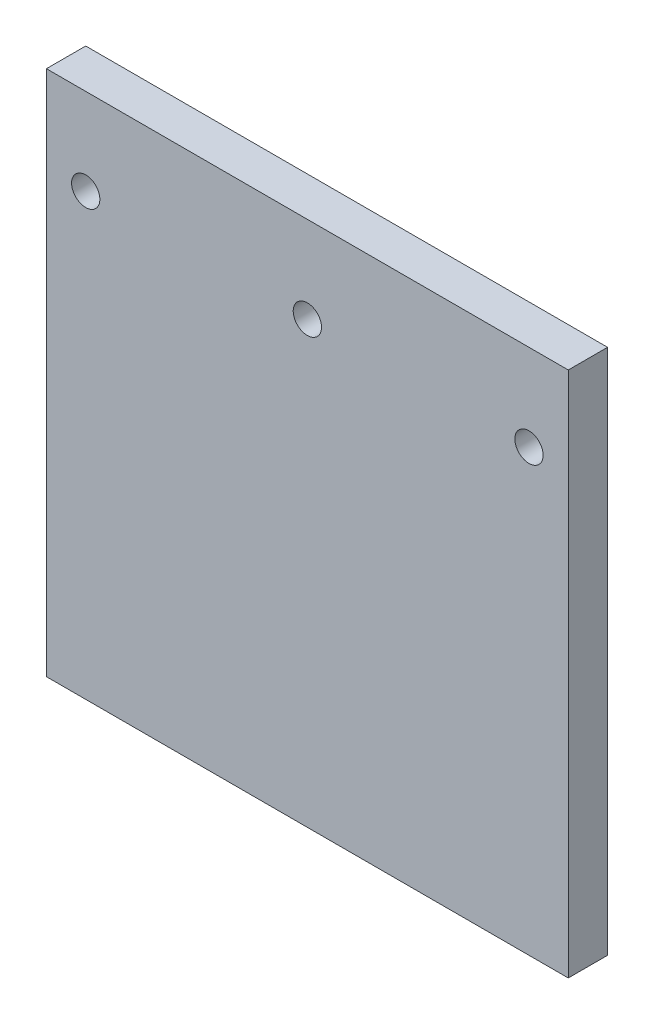
from build123d import *
from build123d.topology import SkipClean

# Parameters (mm, degrees)
SKETCH1_W                = 50
SKETCH1_H                = 9.1
BOSS_EXTRUDE1_DEPTH      = 2
SKETCH2_W                = 25
SKETCH2_H                = 6.6
CUT_EXTRUDE1_DEPTH       = 2
SKETCH3_R                = 1.8
CUT_EXTRUDE2_DEPTH       = 2
SKETCH4_W                = 66.4
SKETCH4_H                = 130
BOSS_EXTRUDE2_DEPTH      = 2
SKETCH5_W                = 66.4
SKETCH5_H                = 2
BOSS_EXTRUDE3_DEPTH      = 2.5
SKETCH6_W                = 8.6
SKETCH6_H                = 62.5
BOSS_EXTRUDE4_DEPTH      = 2
SKETCH7_R                = 1.8
SKETCH7_W                = 3
SKETCH7_H                = 5
CUT_EXTRUDE3_DEPTH       = 2
SKETCH8_W                = 25
SKETCH8_H                = 45
CUT_EXTRUDE4_DEPTH       = 20
SKETCH9_W                = 25
SKETCH9_H                = 10
BOSS_EXTRUDE5_DEPTH      = 2
SKETCH10_W               = 34.7
SKETCH10_H               = 27.07
BOSS_EXTRUDE6_DEPTH      = 2
SKETCH11_R               = 1.8
CUT_EXTRUDE5_DEPTH       = 2
SKETCH12_R               = 1.8
CUT_EXTRUDE6_DEPTH       = 2
SKETCH13_W               = 2
SKETCH13_H               = 2
BOSS_EXTRUDE7_DEPTH      = 44
SKETCH14_W               = 2
SKETCH14_H               = 2
BOSS_EXTRUDE8_DEPTH      = 46
SKETCH16_W               = 42
SKETCH16_H               = 43
BOSS_EXTRUDE10_DEPTH     = 2
SKETCH18_R               = 1.8
CUT_EXTRUDE7_DEPTH       = 2
BOSS_EXTRUDE12_DEPTH     = 2
SKETCH21_W               = 2
SKETCH21_H               = 2
BOSS_EXTRUDE13_DEPTH     = 10
SKETCH25_W               = 3
SKETCH25_H               = 5
CUT_EXTRUDE8_DEPTH       = 10
SKETCH26_W               = 6.2
SKETCH26_H               = 13
SKETCH26_W_2             = 21
SKETCH26_H_2             = 6.6
BOSS_EXTRUDE14_DEPTH     = 2
SKETCH27_W               = 2
SKETCH27_H               = 27
SKETCH27_H_2             = 24.93
BOSS_EXTRUDE15_DEPTH     = 2
SKETCH29_W               = 10
SKETCH29_H               = 10
BOSS_EXTRUDE19_DEPTH     = 2
SKETCH41_R               = 1.8
CUT_EXTRUDE15_DEPTH      = 2
BOSS_EXTRUDE26_DEPTH     = 2
SKETCH43_W               = 70.4
SKETCH43_H               = 2
BOSS_EXTRUDE27_DEPTH     = 11
SKETCH44_W               = 10
SKETCH44_H               = 5
BOSS_EXTRUDE28_DEPTH     = 2
SKETCH45_R               = 1.8
BOSS_EXTRUDE29_DEPTH     = 2
SKETCH46_R               = 1.8
CUT_EXTRUDE16_DEPTH      = 2
SKETCH47_W               = 10
SKETCH47_H               = 1
BOSS_EXTRUDE30_DEPTH     = 2
SKETCH48_W               = 32.7
SKETCH48_H               = 31.07
SKETCH48_W_2             = 101.75
SKETCH48_H_2             = 120.487369876
CUT_EXTRUDE17_DEPTH      = 20
SKETCH50_W               = 66.4
SKETCH50_H               = 81.07
CUT_EXTRUDE19_DEPTH      = 20
SKETCH51_W               = 70.4
SKETCH51_H               = 85.07
SKETCH51_W_2             = 66.4
SKETCH51_H_2             = 81.07
BOSS_EXTRUDE31_DEPTH     = 20
SKETCH52_W               = 10
SKETCH52_H               = 1
BOSS_EXTRUDE32_DEPTH     = 2
SKETCH53_W               = 10
SKETCH53_H               = 4
CUT_EXTRUDE20_DEPTH      = 2
BOSS_EXTRUDE33_START     = 1
SKETCH54_W               = 10
SKETCH54_H               = 12
SKETCH54_R               = 1.8
BOSS_EXTRUDE33_DEPTH     = 1
CUT_EXTRUDE23_DEPTH      = 96
CUT_EXTRUDE23_DEPTH_BACK = 16
SKETCH59_R               = 1.8
SKETCH62_W               = 66.985033768
SKETCH62_H               = 11.249394984
BOSS_EXTRUDE38_DEPTH     = 1
SKETCH65_R               = 1.8
CUT_EXTRUDE27_DEPTH      = 3
SKETCH66_R               = 1
CUT_EXTRUDE28_DEPTH      = 87
BOSS_EXTRUDE41_DEPTH     = 2
BOSS_EXTRUDE42_DEPTH     = 2
BOSS_EXTRUDE43_DEPTH     = 2
SKETCH68_W               = 6.791832398
SKETCH68_H               = 8.144168394
SKETCH68_W_2             = 5.485710784
SKETCH68_W_3             = 7.764004839
SKETCH68_H_2             = 11.628907231
BOSS_EXTRUDE44_DEPTH     = 2
BOSS_EXTRUDE45_DEPTH     = 2
SKETCH70_R               = 1.8
CUT_EXTRUDE29_DEPTH      = 83
SKETCH72_W               = 105.024650177
SKETCH72_H               = 68.649418558
CUT_EXTRUDE33_DEPTH      = 92
SKETCH73_W               = 2
SKETCH73_H               = 22
CUT_EXTRUDE34_DEPTH      = 92
SKETCH74_W               = 66.4
SKETCH74_H               = 2
BOSS_EXTRUDE46_DEPTH     = 45
SKETCH75_W               = 66.4
SKETCH75_H               = 67
SKETCH75_R               = 1.8
BOSS_EXTRUDE47_DEPTH     = 3


with BuildPart() as part:
    # Sketch1 → Boss-Extrude1 (new body)
    with BuildSketch(Plane(origin=(0, 0, 0), x_dir=(1, 0, 0), z_dir=(0, 1, 0))):
        with Locations((25, 4.55)):
            Rectangle(SKETCH1_W, SKETCH1_H)
    extrude(amount=BOSS_EXTRUDE1_DEPTH)

    # Sketch2 → Cut-Extrude1 (cut)
    with BuildSketch(Plane(origin=(0, 2, 0), x_dir=(1, 0, 0), z_dir=(0, 1, 0))):
        with Locations((25, 5.8)):
            Rectangle(SKETCH2_W, SKETCH2_H)
    extrude(amount=-CUT_EXTRUDE1_DEPTH, mode=Mode.SUBTRACT)

    # Sketch3 → Cut-Extrude2 (cut)
    with BuildSketch(Plane(origin=(0, 2, 0), x_dir=(1, 0, 0), z_dir=(0, 1, 0))):
        with Locations(Location((6.25, 5.8, 0), (0, 0, 270))):
            Circle(SKETCH3_R)
        with Locations(Location((43.75, 5.8, 0), (0, 0, 270))):
            Circle(SKETCH3_R)
    extrude(amount=-CUT_EXTRUDE2_DEPTH, mode=Mode.SUBTRACT)

    # Sketch4 → Boss-Extrude2 (add)
    with BuildSketch(Plane(origin=(0, 2, 0), x_dir=(1, 0, 0), z_dir=(0, 1, 0))):
        with Locations((25, -65)):
            Rectangle(SKETCH4_W, SKETCH4_H)
    extrude(amount=-BOSS_EXTRUDE2_DEPTH)

    # Sketch5 → Boss-Extrude3 (add)
    with BuildSketch(Plane.XY.offset(130)):
        with Locations((25, 1)):
            Rectangle(SKETCH5_W, SKETCH5_H)
    extrude(amount=BOSS_EXTRUDE3_DEPTH)

    # Sketch6 → Boss-Extrude4 (add)
    with BuildSketch(Plane(origin=(0, 2, 0), x_dir=(1, 0, 0), z_dir=(0, 1, 0))):
        with Locations((-12.5, -101.25)):
            Rectangle(SKETCH6_W, SKETCH6_H)
        with Locations((62.5, -101.25)):
            Rectangle(SKETCH6_W, SKETCH6_H)
    extrude(amount=-BOSS_EXTRUDE4_DEPTH)

    # Sketch7 → Cut-Extrude3 (cut)
    with BuildSketch(Plane(origin=(0, 2, 0), x_dir=(1, 0, 0), z_dir=(0, 1, 0))):
        with Locations(Location((-13.5, -77, 0), (0, 0, 270))):
            Circle(SKETCH7_R)
        with Locations(Location((-13.5, -101.25, 0), (0, 0, 270))):
            Circle(SKETCH7_R)
        with Locations(Location((-13.5, -125.5, 0), (0, 0, 270))):
            Circle(SKETCH7_R)
        with Locations(Location((63.5, -77, 0), (0, 0, 270))):
            Circle(SKETCH7_R)
        with Locations(Location((63.5, -101.25, 0), (0, 0, 270))):
            Circle(SKETCH7_R)
        with Locations(Location((63.5, -125.5, 0), (0, 0, 270))):
            Circle(SKETCH7_R)
        with Locations((-13.5, -117.5)):
            Rectangle(SKETCH7_W, SKETCH7_H)
        with Locations((63.5, -117.5)):
            Rectangle(SKETCH7_W, SKETCH7_H)
    extrude(amount=-CUT_EXTRUDE3_DEPTH, mode=Mode.SUBTRACT)

    # Sketch8 → Cut-Extrude4 (cut)
    with BuildSketch(Plane(origin=(0, 2, 0), x_dir=(1, 0, 0), z_dir=(0, 1, 0))):
        with Locations((25, -22.5)):
            Rectangle(SKETCH8_W, SKETCH8_H)
    extrude(amount=-CUT_EXTRUDE4_DEPTH, mode=Mode.SUBTRACT)

    # Sketch9 → Boss-Extrude5 (add)
    with BuildSketch(Plane(origin=(0, 2, 0), x_dir=(1, 0, 0), z_dir=(0, 1, 0))):
        with Locations((25, -5)):
            Rectangle(SKETCH9_W, SKETCH9_H)
    extrude(amount=-BOSS_EXTRUDE5_DEPTH)

    # Sketch10 → Boss-Extrude6 (add)
    with BuildSketch(Plane(origin=(0, 2, 0), x_dir=(1, 0, 0), z_dir=(0, 1, 0))):
        with Locations((-25.55, -29.535)):
            Rectangle(SKETCH10_W, SKETCH10_H)
        with Locations((75.55, -29.535)):
            Rectangle(SKETCH10_W, SKETCH10_H)
    extrude(amount=-BOSS_EXTRUDE6_DEPTH)

    # Sketch11 → Cut-Extrude5 (cut)
    with BuildSketch(Plane(origin=(0, 2, 0), x_dir=(1, 0, 0), z_dir=(0, 1, 0))):
        with Locations(Location((-36.9, -19.25, 0), (0, 0, 270))):
            Circle(SKETCH11_R)
        with Locations(Location((-36.9, -39.82, 0), (0, 0, 270))):
            Circle(SKETCH11_R)
        with Locations(Location((-22.6, -19.25, 0), (0, 0, 270))):
            Circle(SKETCH11_R)
        with Locations(Location((-22.6, -39.82, 0), (0, 0, 270))):
            Circle(SKETCH11_R)
    extrude(amount=-CUT_EXTRUDE5_DEPTH, mode=Mode.SUBTRACT)

    # Sketch12 → Cut-Extrude6 (cut)
    with BuildSketch(Plane(origin=(0, 2, 0), x_dir=(1, 0, 0), z_dir=(0, 1, 0))):
        with Locations(Location((72.6, -19.25, 0), (0, 0, 270))):
            Circle(SKETCH12_R)
        with Locations(Location((86.9, -19.25, 0), (0, 0, 270))):
            Circle(SKETCH12_R)
        with Locations(Location((72.6, -39.82, 0), (0, 0, 270))):
            Circle(SKETCH12_R)
        with Locations(Location((86.9, -39.82, 0), (0, 0, 270))):
            Circle(SKETCH12_R)
    extrude(amount=-CUT_EXTRUDE6_DEPTH, mode=Mode.SUBTRACT)

    # Sketch13 → Boss-Extrude7 (add)
    with BuildSketch(Plane.ZY.offset(42.9)):
        with Locations((15, 1)):
            Rectangle(SKETCH13_W, SKETCH13_H)
        with Locations((44.07, 1)):
            Rectangle(SKETCH13_W, SKETCH13_H)
    extrude(amount=-BOSS_EXTRUDE7_DEPTH)

    # Sketch14 → Boss-Extrude8 (add)
    with BuildSketch(Plane(origin=(92.9, 0, 0), x_dir=(0, 0, -1), z_dir=(1, 0, 0))):
        with Locations((-15, 1)):
            Rectangle(SKETCH14_W, SKETCH14_H)
        with Locations((-44.07, 1)):
            Rectangle(SKETCH14_W, SKETCH14_H)
    extrude(amount=-BOSS_EXTRUDE8_DEPTH)

    # Sketch16 → Boss-Extrude10 (add)
    with BuildSketch(Plane(origin=(0, 2, 0), x_dir=(1, 0, 0), z_dir=(0, 1, 0))):
        with Locations((25, -154)):
            Rectangle(SKETCH16_W, SKETCH16_H)
    extrude(amount=-BOSS_EXTRUDE10_DEPTH)

    # Sketch18 → Cut-Extrude7 (cut)
    with BuildSketch(Plane(origin=(0, 2, 0), x_dir=(1, 0, 0), z_dir=(0, 1, 0))):
        with Locations(Location((8.74, -171.03, 0), (0, 0, 270))):
            Circle(SKETCH18_R)
        with Locations(Location((41.26, -171.03, 0), (0, 0, 270))):
            Circle(SKETCH18_R)
        with Locations(Location((8.74, -138.5, 0), (0, 0, 270))):
            Circle(SKETCH18_R)
        with Locations(Location((41.26, -138.5, 0), (0, 0, 270))):
            Circle(SKETCH18_R)
    extrude(amount=-CUT_EXTRUDE7_DEPTH, mode=Mode.SUBTRACT)

    # Sketch20 → Boss-Extrude12 (add)
    with BuildSketch(Plane(origin=(0, 2, 0), x_dir=(1, 0, 0), z_dir=(0, 1, 0))):
        with BuildLine():
            Line((-2, -132.5), (4, -132.5))
            Line((4, -132.5), (4, -138.5))
            ThreePointArc((4, -138.5), (2.242640687, -134.257359313), (-2, -132.5))
        make_face()
        with BuildLine():
            ThreePointArc((52, -132.5), (47.757359313, -134.257359313), (46, -138.5))
            Line((46, -138.5), (46, -132.5))
            Line((46, -132.5), (52, -132.5))
        make_face()
    extrude(amount=-BOSS_EXTRUDE12_DEPTH)

    # Sketch21 → Boss-Extrude13 (add)
    with BuildSketch(Plane(origin=(0, 0, -9.1), x_dir=(-1, 0, 0), z_dir=(0, 0, -1))):
        with Locations((-51, 1)):
            Rectangle(SKETCH21_W, SKETCH21_H)
        with Locations((-36.5, 1)):
            Rectangle(SKETCH21_W, SKETCH21_H)
        with Locations((-13.5, 1)):
            Rectangle(SKETCH21_W, SKETCH21_H)
        with Locations((1, 1)):
            Rectangle(SKETCH21_W, SKETCH21_H)
    extrude(amount=-BOSS_EXTRUDE13_DEPTH)

    # Sketch25 → Cut-Extrude8 (cut)
    with BuildSketch(Plane(origin=(0, 2, 0), x_dir=(1, 0, 0), z_dir=(0, 1, 0))):
        with Locations((-11.7, -22.5)):
            Rectangle(SKETCH25_W, SKETCH25_H)
        with Locations((-11.7, -36.57)):
            Rectangle(SKETCH25_W, SKETCH25_H)
        with Locations((61.7, -22.5)):
            Rectangle(SKETCH25_W, SKETCH25_H)
        with Locations((61.7, -36.57)):
            Rectangle(SKETCH25_W, SKETCH25_H)
    extrude(amount=-CUT_EXTRUDE8_DEPTH, mode=Mode.SUBTRACT)

    # Sketch26 → Boss-Extrude14 (add)
    with BuildSketch(Plane(origin=(0, 2, 0), x_dir=(1, 0, 0), z_dir=(0, 1, 0))):
        with Locations((-5.1, 6.5)):
            Rectangle(SKETCH26_W, SKETCH26_H)
        Polygon((-2, 13), (-2, 9.1), (14.5, 9.1), (35.5, 9.1), (52, 9.1), (52, 13), align=None)
        with Locations((25, 5.8)):
            Rectangle(SKETCH26_W_2, SKETCH26_H_2)
        with Locations((55.1, 6.5)):
            Rectangle(SKETCH26_W, SKETCH26_H)
    extrude(amount=-BOSS_EXTRUDE14_DEPTH)

    # Sketch27 → Boss-Extrude15 (add)
    with BuildSketch(Plane(origin=(0, 2, 0), x_dir=(1, 0, 0), z_dir=(0, 1, 0))):
        with Locations((-9.2, -0.5)):
            Rectangle(SKETCH27_W, SKETCH27_H)
        with Locations((-9.2, -57.535)):
            Rectangle(SKETCH27_W, SKETCH27_H_2)
        with Locations((59.2, -0.5)):
            Rectangle(SKETCH27_W, SKETCH27_H)
        with Locations((59.2, -57.535)):
            Rectangle(SKETCH27_W, SKETCH27_H_2)
    extrude(amount=-BOSS_EXTRUDE15_DEPTH)

    # Sketch29 → Boss-Extrude19 (add)
    with BuildSketch(Plane(origin=(0, 2, 0), x_dir=(1, 0, 0), z_dir=(0, 1, 0))):
        with Locations((-15.2, -9)):
            Rectangle(SKETCH29_W, SKETCH29_H)
        with Locations((-15.2, -50.07)):
            Rectangle(SKETCH29_W, SKETCH29_H)
        with Locations((65.2, -9)):
            Rectangle(SKETCH29_W, SKETCH29_H)
        with Locations((65.2, -50.07)):
            Rectangle(SKETCH29_W, SKETCH29_H)
    extrude(amount=-BOSS_EXTRUDE19_DEPTH)

    # Sketch41 → Cut-Extrude15 (cut)
    with BuildSketch(Plane(origin=(0, 2, 0), x_dir=(1, 0, 0), z_dir=(0, 1, 0))):
        with Locations(Location((-15.2, -9, 0), (0, 0, 270))):
            Circle(SKETCH41_R)
        with Locations(Location((-15.2, -50.07, 0), (0, 0, 270))):
            Circle(SKETCH41_R)
        with Locations(Location((65.2, -9, 0), (0, 0, 270))):
            Circle(SKETCH41_R)
        with Locations(Location((65.2, -50.07, 0), (0, 0, 270))):
            Circle(SKETCH41_R)
    extrude(amount=-CUT_EXTRUDE15_DEPTH, mode=Mode.SUBTRACT)

    # Sketch42 → Boss-Extrude26 (add)
    with BuildSketch(Plane(origin=(0, 2, 0), x_dir=(1, 0, 0), z_dir=(0, 1, 0))):
        with BuildLine():
            Line((-16.8, -70), (-10.2, -70))
            Line((-10.2, -70), (-10.2, -63.4))
            ThreePointArc((-10.2, -63.4), (-12.133095244, -68.066904756), (-16.8, -70))
        make_face()
        with BuildLine():
            Line((60.2, -63.4), (60.2, -70))
            Line((60.2, -70), (66.8, -70))
            ThreePointArc((66.8, -70), (62.133095244, -68.066904756), (60.2, -63.4))
        make_face()
    extrude(amount=-BOSS_EXTRUDE26_DEPTH)

    # Sketch43 → Boss-Extrude27 (add)
    with BuildSketch(Plane(origin=(0, 0, -13), x_dir=(-1, 0, 0), z_dir=(0, 0, -1))):
        with Locations((-25, 1)):
            Rectangle(SKETCH43_W, SKETCH43_H)
    extrude(amount=BOSS_EXTRUDE27_DEPTH)

    # Sketch44 → Boss-Extrude28 (add)
    with BuildSketch(Plane(origin=(0, 2, 0), x_dir=(1, 0, 0), z_dir=(0, 1, 0))):
        with Locations((-15.2, -57.57)):
            Rectangle(SKETCH44_W, SKETCH44_H)
        with Locations((65.2, -57.57)):
            Rectangle(SKETCH44_W, SKETCH44_H)
    extrude(amount=-BOSS_EXTRUDE28_DEPTH)

    # Sketch45 → Boss-Extrude29 (add)
    with BuildSketch(Plane(origin=(0, 2, 0), x_dir=(1, 0, 0), z_dir=(0, 1, 0))):
        with Locations((-15.2, -50.07)):
            Circle(SKETCH45_R)
        with Locations((65.2, -50.07)):
            Circle(SKETCH45_R)
    extrude(amount=-BOSS_EXTRUDE29_DEPTH)

    # Sketch46 → Cut-Extrude16 (cut)
    with BuildSketch(Plane(origin=(0, 2, 0), x_dir=(1, 0, 0), z_dir=(0, 1, 0))):
        with Locations(Location((-15.2, -55.07, 0), (0, 0, 270))):
            Circle(SKETCH46_R)
        with Locations(Location((65.2, -55.07, 0), (0, 0, 270))):
            Circle(SKETCH46_R)
    extrude(amount=-CUT_EXTRUDE16_DEPTH, mode=Mode.SUBTRACT)

    # Sketch47 → Boss-Extrude30 (add)
    with BuildSketch(Plane(origin=(0, 2, 0), x_dir=(1, 0, 0), z_dir=(0, 1, 0))):
        with Locations((-15.2, -3.5)):
            Rectangle(SKETCH47_W, SKETCH47_H)
        with Locations((-15.2, -60.57)):
            Rectangle(SKETCH47_W, SKETCH47_H)
        with Locations((65.2, -3.5)):
            Rectangle(SKETCH47_W, SKETCH47_H)
        with Locations((65.2, -60.57)):
            Rectangle(SKETCH47_W, SKETCH47_H)
    extrude(amount=-BOSS_EXTRUDE30_DEPTH)

    # Sketch48 → Cut-Extrude17 (cut)
    with BuildSketch(Plane(origin=(0, 2, 0), x_dir=(1, 0, 0), z_dir=(0, 1, 0))):
        with Locations((-26.55, -29.535)):
            Rectangle(SKETCH48_W, SKETCH48_H)
        with Locations((76.55, -29.535)):
            Rectangle(SKETCH48_W, SKETCH48_H)
        with Locations((30.675, -121.313684938)):
            Rectangle(SKETCH48_W_2, SKETCH48_H_2)
    extrude(amount=-CUT_EXTRUDE17_DEPTH, mode=Mode.SUBTRACT)

    # Sketch50 → Cut-Extrude19 (cut)
    with BuildSketch(Plane(origin=(0, 2, 0), x_dir=(1, 0, 0), z_dir=(0, 1, 0))):
        with Locations((25, -18.535)):
            Rectangle(SKETCH50_W, SKETCH50_H)
    extrude(amount=-CUT_EXTRUDE19_DEPTH, mode=Mode.SUBTRACT)

    # Sketch51 → Boss-Extrude31 (add)
    with BuildSketch(Plane(origin=(0, 2, 0), x_dir=(1, 0, 0), z_dir=(0, 1, 0))):
        with Locations((25, -18.535)):
            Rectangle(SKETCH51_W, SKETCH51_H)
        with Locations((25, -18.535)):
            Rectangle(SKETCH51_W_2, SKETCH51_H_2, mode=Mode.SUBTRACT)
    extrude(amount=BOSS_EXTRUDE31_DEPTH)

    # Sketch52 → Boss-Extrude32 (add)
    with BuildSketch(Plane(origin=(0, 2, 0), x_dir=(1, 0, 0), z_dir=(0, 1, 0))):
        with Locations((-15.2, -14.5)):
            Rectangle(SKETCH52_W, SKETCH52_H)
        with Locations((65.2, -14.5)):
            Rectangle(SKETCH52_W, SKETCH52_H)
    extrude(amount=-BOSS_EXTRUDE32_DEPTH)

    # Sketch53 → Cut-Extrude20 (cut)
    with BuildSketch(Plane(origin=(0, 2, 0), x_dir=(1, 0, 0), z_dir=(0, 1, 0))):
        with Locations((-15.2, -47.07)):
            Rectangle(SKETCH53_W, SKETCH53_H)
        with Locations((65.2, -47.07)):
            Rectangle(SKETCH53_W, SKETCH53_H)
    extrude(amount=-CUT_EXTRUDE20_DEPTH, mode=Mode.SUBTRACT)

    # Sketch54 → Boss-Extrude33 (add)
    # profile 1 of 4: a face of its own
    with BuildSketch(Plane(origin=(0, 2, 0), x_dir=(1, 0, 0), z_dir=(0, 1, 0)).offset(BOSS_EXTRUDE33_START)):
        with Locations((-15.2, -9)):
            Rectangle(SKETCH54_W, SKETCH54_H)
        with Locations(Location((-15.2, -9, 0), (0, 0, 270))):
            Circle(SKETCH54_R, mode=Mode.SUBTRACT)
    # profile 2 of 4: a face of its own
    with BuildSketch(Plane(origin=(0, 2, 0), x_dir=(1, 0, 0), z_dir=(0, 1, 0)).offset(BOSS_EXTRUDE33_START)):
        with Locations((-15.2, -55.07)):
            Rectangle(SKETCH54_W, SKETCH54_H)
        with Locations(Location((-15.2, -55.07, 0), (0, 0, 270))):
            Circle(SKETCH54_R, mode=Mode.SUBTRACT)
    # profile 3 of 4: a face of its own
    with BuildSketch(Plane(origin=(0, 2, 0), x_dir=(1, 0, 0), z_dir=(0, 1, 0)).offset(BOSS_EXTRUDE33_START)):
        with Locations((65.2, -9)):
            Rectangle(SKETCH54_W, SKETCH54_H)
        with Locations(Location((65.2, -9, 0), (0, 0, 270))):
            Circle(SKETCH54_R, mode=Mode.SUBTRACT)
    # profile 4 of 4: a face of its own
    with BuildSketch(Plane(origin=(0, 2, 0), x_dir=(1, 0, 0), z_dir=(0, 1, 0)).offset(BOSS_EXTRUDE33_START)):
        with Locations((65.2, -55.07)):
            Rectangle(SKETCH54_W, SKETCH54_H)
        with Locations(Location((65.2, -55.07, 0), (0, 0, 270))):
            Circle(SKETCH54_R, mode=Mode.SUBTRACT)
    extrude(amount=-BOSS_EXTRUDE33_DEPTH)

    # Sketch59 → Cut-Extrude23 (cut, two sides: drawn at the far end of the back side and taken through both)
    with BuildSketch(Plane.XY.offset(-22).offset(-CUT_EXTRUDE23_DEPTH_BACK)):
        with Locations((-3.2, 11)):
            Circle(SKETCH59_R)
        with Locations((53.2, 11)):
            Circle(SKETCH59_R)
        with Locations((25, 11)):
            Circle(SKETCH59_R)
    extrude(amount=CUT_EXTRUDE23_DEPTH + CUT_EXTRUDE23_DEPTH_BACK, mode=Mode.SUBTRACT)

    # Sketch62 → Boss-Extrude38 (add)
    with BuildSketch(Plane.XY.offset(61.07)):
        with Locations((24.914777311, 10.744331932)):
            Rectangle(SKETCH62_W, SKETCH62_H)
    extrude(amount=-BOSS_EXTRUDE38_DEPTH)

    # Sketch65 → Cut-Extrude27 (cut)
    with BuildSketch(Plane(origin=(0, 0, 59.07), x_dir=(-1, 0, 0), z_dir=(0, 0, -1))):
        with Locations((-13.8, 11)):
            Circle(SKETCH65_R)
        with Locations((-36.2, 11)):
            Circle(SKETCH65_R)
    extrude(amount=-CUT_EXTRUDE27_DEPTH, mode=Mode.SUBTRACT)

    # Sketch66 → Cut-Extrude28 (cut)
    with BuildSketch(Plane.ZY.offset(10.2)):
        with Locations((32.035, 16)):
            Circle(SKETCH66_R)
    extrude(amount=-CUT_EXTRUDE28_DEPTH, mode=Mode.SUBTRACT)

    # Sketch55 → Boss-Extrude41 (add)
    with BuildSketch(Plane(origin=(0, 0, 3), x_dir=(-1, 0, 0), z_dir=(0, 0, -1))):
        Polygon((20.2, 3), (10.2, 22), (10.2, 3), align=None)
        Polygon((-70.2, 3), (-60.2, 3), (-60.2, 22), align=None)
    extrude(amount=-BOSS_EXTRUDE41_DEPTH)

    # Sketch56 → Boss-Extrude42 (add)
    with BuildSketch(Plane.XY.offset(15)):
        Polygon((-20.2, 3), (-10.2, 3), (-10.2, 22), align=None)
        Polygon((70.2, 3), (60.2, 3), (60.2, 22), align=None)
    extrude(amount=-BOSS_EXTRUDE42_DEPTH)

    # Sketch57 → Boss-Extrude43 (add)
    with BuildSketch(Plane(origin=(0, 0, 49.07), x_dir=(-1, 0, 0), z_dir=(0, 0, -1))):
        Polygon((20.2, 3), (10.2, 3), (10.2, 22), align=None)
        Polygon((-70.2, 3), (-60.2, 3), (-60.2, 22), align=None)
    extrude(amount=-BOSS_EXTRUDE43_DEPTH)

    # Sketch68 → Boss-Extrude44 (add)
    with BuildSketch(Plane(origin=(0, 0, 59.07), x_dir=(-1, 0, 0), z_dir=(0, 0, -1))):
        with Locations((2.499419559, 10.346452983)):
            Rectangle(SKETCH68_W, SKETCH68_H)
        with Locations((-24.624372648, 10.346452983)):
            Rectangle(SKETCH68_W_2, SKETCH68_H)
        with Locations((-52.231743322, 12.088822401)):
            Rectangle(SKETCH68_W_3, SKETCH68_H_2)
    extrude(amount=-BOSS_EXTRUDE44_DEPTH)

    # Sketch69 → Boss-Extrude45 (add)
    with BuildSketch(Plane.XY.offset(61.07)):
        Polygon((-20.2, 3), (-10.2, 3), (-10.2, 22), align=None)
        Polygon((60.2, 3), (70.2, 3), (60.2, 22), align=None)
    extrude(amount=-BOSS_EXTRUDE45_DEPTH)

    # Sketch70 → Cut-Extrude29 (cut)
    with BuildSketch(Plane.ZY.offset(10.2)):
        with Locations((9, 17)):
            Circle(SKETCH70_R)
        with Locations((55.07, 17)):
            Circle(SKETCH70_R)
    extrude(amount=-CUT_EXTRUDE29_DEPTH, mode=Mode.SUBTRACT)

    # Sketch72 → Cut-Extrude33 (cut)
    with BuildSketch(Plane.XY.offset(-22)):
        with Locations((30.741682618, -12.324709279)):
            Rectangle(SKETCH72_W, SKETCH72_H)
    extrude(amount=CUT_EXTRUDE33_DEPTH, mode=Mode.SUBTRACT)

    # Sketch73 → Cut-Extrude34 (cut)
    with BuildSketch(Plane.XY.offset(-22)):
        with Locations((-9.2, 11)):
            Rectangle(SKETCH73_W, SKETCH73_H)
        with Locations((59.2, 11)):
            Rectangle(SKETCH73_W, SKETCH73_H)
    extrude(amount=-CUT_EXTRUDE34_DEPTH, mode=Mode.SUBTRACT)

    # Sketch74 → Boss-Extrude46 (add)
    with BuildSketch(Plane(origin=(0, 0, 0), x_dir=(-1, 0, 0), z_dir=(0, -1, 0))):
        with Locations((-25, 23)):
            Rectangle(SKETCH74_W, SKETCH74_H)
    extrude(amount=BOSS_EXTRUDE46_DEPTH)

    # Sketch75 → Boss-Extrude47 (add)
    with SkipClean():  # the faces are left unmerged after this step: merging them gives an invalid solid
        with BuildSketch(Plane(origin=(0, 0, -24), x_dir=(-1, 0, 0), z_dir=(0, 0, -1))):
            with Locations((-25, -11.5)):
                Rectangle(SKETCH75_W, SKETCH75_H)
            with Locations((-53.2, 11)):
                Circle(SKETCH75_R, mode=Mode.SUBTRACT)
            with Locations((-25, 11)):
                Circle(SKETCH75_R, mode=Mode.SUBTRACT)
            with Locations((3.2, 11)):
                Circle(SKETCH75_R, mode=Mode.SUBTRACT)
        extrude(amount=BOSS_EXTRUDE47_DEPTH)


solid = part.part
